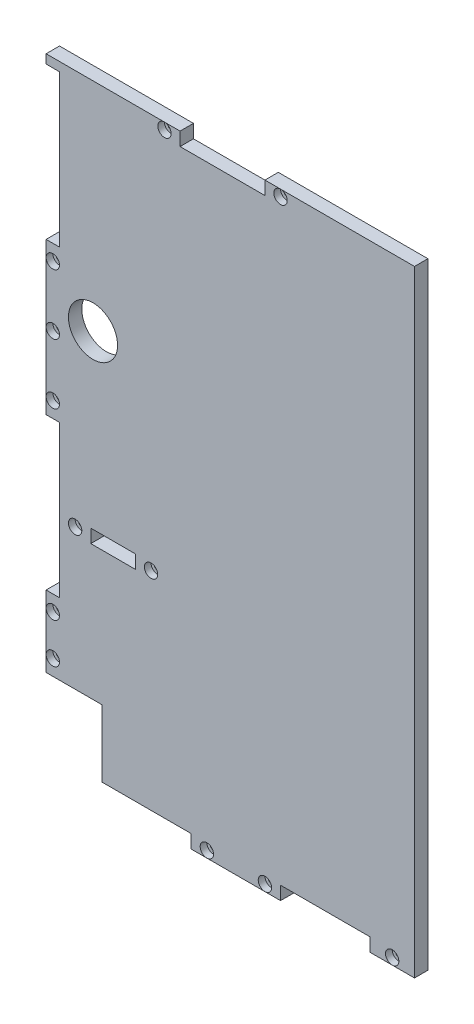
from build123d import *

# Parameters (mm, degrees)
ESQUISSE1_W             = 165
ESQUISSE1_H             = 276
BOSS_EXTRU_1_DEPTH      = 6
ESQUISSE2_W             = 38
ESQUISSE2_H             = 6
ESQUISSE2_W_2           = 6
ESQUISSE2_H_2           = 68
ESQUISSE2_W_3           = 40
EXTERIEUR_DEPTH         = 10
ESQUISSE3_R             = 11
ESQUISSE3_W             = 20
ESQUISSE3_H             = 6
ENL_V_MAT_EXTRU_2_DEPTH = 322.616230934
ESQUISSE4_R             = 1.5
ENL_V_MAT_EXTRU_3_DEPTH = 322.616230934
ESQUISSE5_R             = 2.995
ESQUISSE5_R_2           = 3
ENL_V_MAT_EXTRU_4_DEPTH = 3


with BuildPart() as part:
    # Esquisse1 → Boss.-Extru.1 (new body)
    with BuildSketch(Plane.XY):
        with Locations((-82.5, 138)):
            Rectangle(ESQUISSE1_W, ESQUISSE1_H)
    extrude(amount=BOSS_EXTRU_1_DEPTH)

    # Esquisse2 → exterieur (cut)
    with BuildSketch(Plane.XY.offset(6)):
        with Locations((-86, 273)):
            Rectangle(ESQUISSE2_W, ESQUISSE2_H)
        with Locations((-162, 238)):
            Rectangle(ESQUISSE2_W_2, ESQUISSE2_H_2)
        with Locations((-162, 102)):
            Rectangle(ESQUISSE2_W_2, ESQUISSE2_H_2)
        Polygon((-140, 36), (-140, 6), (-100, 6), (-100, 0), (-165, 0), (-165, 36), align=None)
        with Locations((-40, 3)):
            Rectangle(ESQUISSE2_W_3, ESQUISSE2_H)
    extrude(amount=-EXTERIEUR_DEPTH, mode=Mode.SUBTRACT)

    # Esquisse3 → Enlèv. mat.-Extru.2 (cut, through all)
    with BuildSketch(Plane.XY.offset(6)):
        with Locations((-144, 178.92)):
            Circle(ESQUISSE3_R)
        with Locations((-135, 99)):
            Rectangle(ESQUISSE3_W, ESQUISSE3_H)
    extrude(amount=-ENL_V_MAT_EXTRU_2_DEPTH, mode=Mode.SUBTRACT)

    # Esquisse4 → Enlèv. mat.-Extru.3 (cut, through all)
    with BuildSketch(Plane.XY.offset(6)):
        with Locations((-60, 273)):
            Circle(ESQUISSE4_R)
        with Locations((-112, 273)):
            Circle(ESQUISSE4_R)
        with Locations((-162, 197)):
            Circle(ESQUISSE4_R)
        with Locations((-162, 170)):
            Circle(ESQUISSE4_R)
        with Locations((-162, 143)):
            Circle(ESQUISSE4_R)
        with Locations((-162, 61)):
            Circle(ESQUISSE4_R)
        with Locations((-162, 43)):
            Circle(ESQUISSE4_R)
        with Locations((-93, 3)):
            Circle(ESQUISSE4_R)
        with Locations((-67, 3)):
            Circle(ESQUISSE4_R)
        with Locations((-10, 3)):
            Circle(ESQUISSE4_R)
        with Locations((-152, 99)):
            Circle(ESQUISSE4_R)
        with Locations((-118, 99)):
            Circle(ESQUISSE4_R)
    extrude(amount=-ENL_V_MAT_EXTRU_3_DEPTH, mode=Mode.SUBTRACT)

    # Esquisse5 → Enlèv. mat.-Extru.4 (cut)
    with BuildSketch(Plane.XY.offset(6)):
        with Locations((-112, 273)):
            Circle(ESQUISSE5_R)
        with Locations((-60, 273)):
            Circle(ESQUISSE5_R)
        with Locations((-162, 197)):
            Circle(ESQUISSE5_R)
        with Locations((-162, 170)):
            Circle(ESQUISSE5_R)
        with Locations((-162, 143)):
            Circle(ESQUISSE5_R)
        with Locations((-162, 61)):
            Circle(ESQUISSE5_R)
        with Locations((-162, 43)):
            Circle(ESQUISSE5_R)
        with Locations((-93, 3)):
            Circle(ESQUISSE5_R)
        with Locations((-67, 3)):
            Circle(ESQUISSE5_R)
        with Locations((-10, 3)):
            Circle(ESQUISSE5_R)
        with Locations((-152, 99)):
            Circle(ESQUISSE5_R_2)
        with Locations((-118, 99)):
            Circle(ESQUISSE5_R_2)
    extrude(amount=-ENL_V_MAT_EXTRU_4_DEPTH, mode=Mode.SUBTRACT)


solid = part.part
